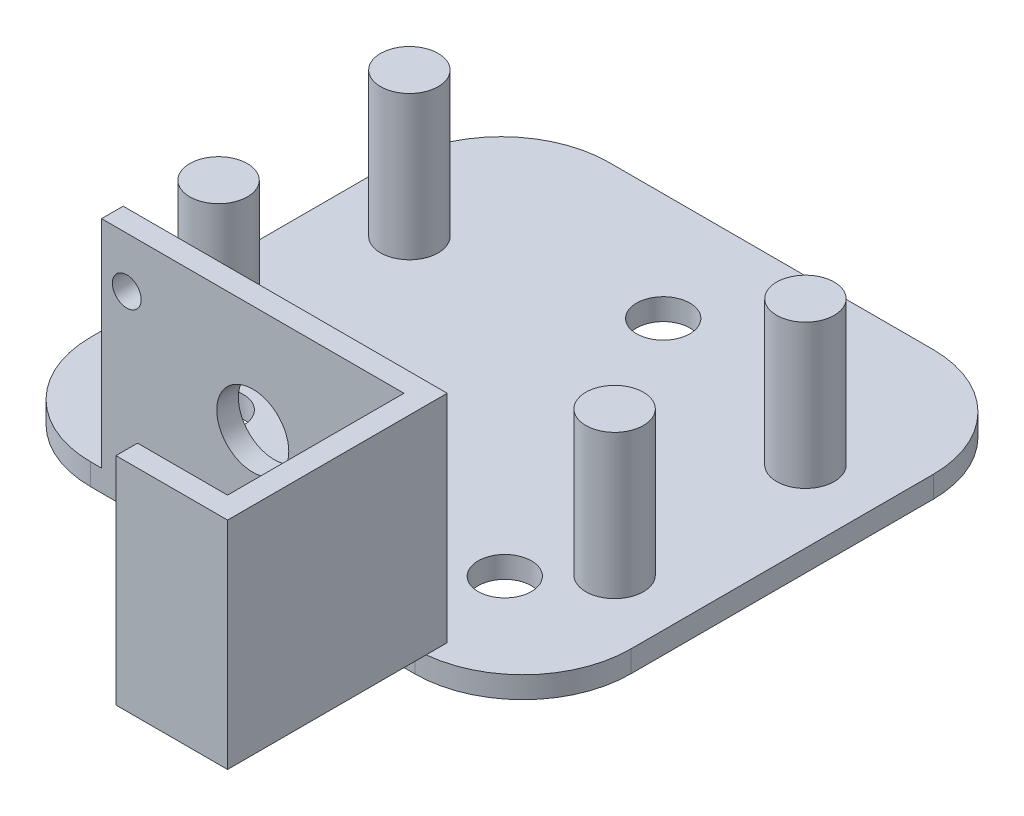
from build123d import *

# Parameters (mm, degrees)
SKETCH1_R           = 3.7
BOSS_EXTRUDE1_DEPTH = 3
SKETCH3_R           = 4
BOSS_EXTRUDE3_DEPTH = 20
BOSS_EXTRUDE5_DEPTH = 30
CUT_EXTRUDE1_REACH  = 89.631
SKETCH6_R           = 5
SKETCH6_R_2         = 2
SKETCH8_W           = 3
SKETCH8_H           = 30
BOSS_EXTRUDE6_DEPTH = 12.5


with BuildPart() as part:
    # Sketch1 → Boss-Extrude1 (new body)
    with BuildSketch(Plane(origin=(0, 0, 0), x_dir=(1, 0, 0), z_dir=(0, 1, 0))):
        with BuildLine():
            Line((-37.5, -21), (-37.5, 21))
            ThreePointArc((-37.5, 21), (-33.106601718, 31.606601718), (-22.5, 36))
            Line((-22.5, 36), (22.5, 36))
            ThreePointArc((22.5, 36), (33.106601718, 31.606601718), (37.5, 21))
            Line((37.5, 21), (37.5, -21))
            ThreePointArc((37.5, -21), (33.106601718, -31.606601718), (22.5, -36))
            Line((22.5, -36), (-22.5, -36))
            ThreePointArc((-22.5, -36), (-33.106601718, -31.606601718), (-37.5, -21))
        make_face()
        with Locations(Location((0, 21, 0), (0, 0, 270))):
            Circle(SKETCH1_R, mode=Mode.SUBTRACT)
        with Locations(Location((-20, -21, 0), (0, 0, 270))):
            Circle(SKETCH1_R, mode=Mode.SUBTRACT)
        with Locations(Location((20, -21, 0), (0, 0, 270))):
            Circle(SKETCH1_R, mode=Mode.SUBTRACT)
    extrude(amount=BOSS_EXTRUDE1_DEPTH)

    # Sketch3 → Boss-Extrude3 (add)
    with BuildSketch(Plane(origin=(0, 3, -40.87670084), x_dir=(-1, 0, 0), z_dir=(0, 1, 0))):
        with Locations(Location((-27.5, 27.62670084, 0), (0, 0, 90))):
            Circle(SKETCH3_R)
        with Locations(Location((27.5, 54.12670084, 0), (0, 0, 90))):
            Circle(SKETCH3_R)
        with Locations(Location((-27.5, 54.12670084, 0), (0, 0, 90))):
            Circle(SKETCH3_R)
        with Locations(Location((27.5, 27.62670084, 0), (0, 0, 90))):
            Circle(SKETCH3_R)
    extrude(amount=BOSS_EXTRUDE3_DEPTH)

    # Sketch5 → Boss-Extrude5 (add)
    with BuildSketch(Plane(origin=(0, 3, 0), x_dir=(1, 0, 0), z_dir=(0, 1, 0))):
        Polygon((24, -63.5), (24, -36), (24, -33), (-21, -33), (-21, -36), (21, -36), (21, -63.5), align=None)
    extrude(amount=BOSS_EXTRUDE5_DEPTH)

    # Sketch6 → Cut-Extrude1 (cut, up to next)
    with BuildSketch(Plane.XY.offset(36), mode=Mode.PRIVATE) as cut_extrude1_sk1:
        with Locations((0, 18)):
            Circle(SKETCH6_R)
    cut_extrude1_tool1 = extrude(cut_extrude1_sk1.sketch, amount=-CUT_EXTRUDE1_REACH, mode=Mode.PRIVATE) & part.part
    # Sketch6 → Cut-Extrude1 (cut, up to next)
    with BuildSketch(Plane.XY.offset(36), mode=Mode.PRIVATE) as cut_extrude1_sk2:
        with Locations((-17.5, 26)):
            Circle(SKETCH6_R_2)
    cut_extrude1_tool2 = extrude(cut_extrude1_sk2.sketch, amount=-CUT_EXTRUDE1_REACH, mode=Mode.PRIVATE) & part.part
    # Sketch6 → Cut-Extrude1 (cut, up to next)
    with BuildSketch(Plane.XY.offset(36), mode=Mode.PRIVATE) as cut_extrude1_sk3:
        with Locations((17.5, 26)):
            Circle(SKETCH6_R_2)
    cut_extrude1_tool3 = extrude(cut_extrude1_sk3.sketch, amount=-CUT_EXTRUDE1_REACH, mode=Mode.PRIVATE) & part.part
    add(cut_extrude1_tool1.solids().sort_by_distance((0, 18, 36))[0], mode=Mode.SUBTRACT)
    add(cut_extrude1_tool2.solids().sort_by_distance((-17.5, 26, 36))[0], mode=Mode.SUBTRACT)
    add(cut_extrude1_tool3.solids().sort_by_distance((17.5, 26, 36))[0], mode=Mode.SUBTRACT)

    # Sketch8 → Boss-Extrude6 (add)
    with BuildSketch(Plane.ZY.offset(-21)):
        with Locations((62, 18)):
            Rectangle(SKETCH8_W, SKETCH8_H)
    extrude(amount=BOSS_EXTRUDE6_DEPTH)


solid = part.part
